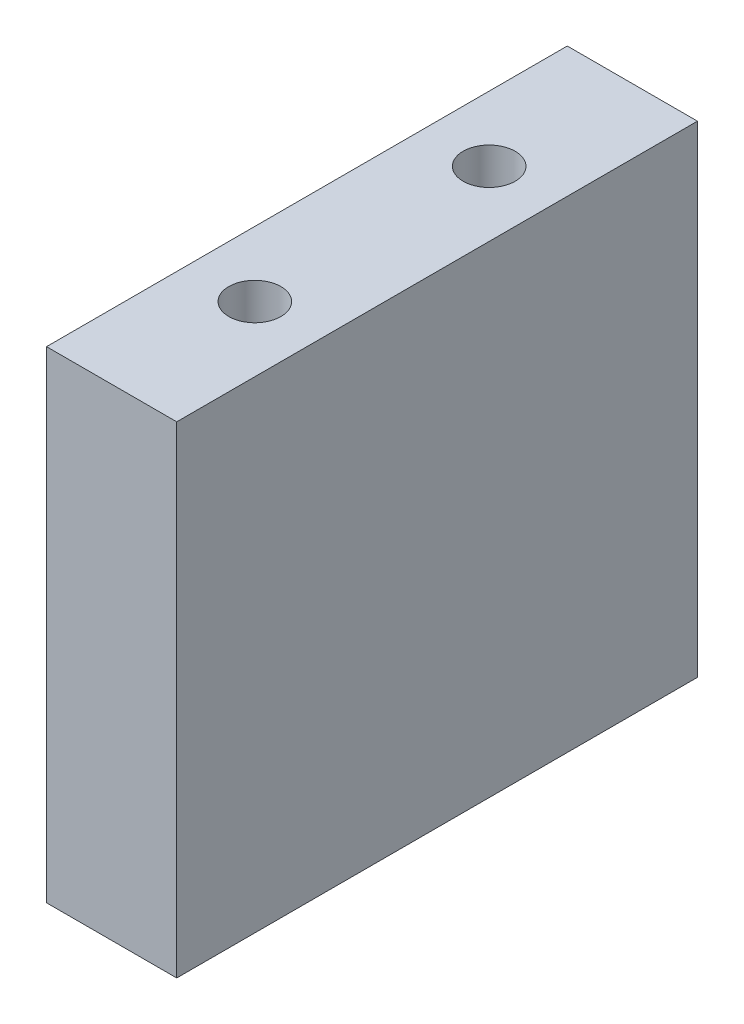
from build123d import *

# Parameters (mm, degrees)
CROQUIS1_W              = 80
CROQUIS1_H              = 74
SALIENTE_EXTRUIR1_DEPTH = 20
CROQUIS3_R              = 4
CORTAR_EXTRUIR2_DEPTH   = 25
CROQUIS4_R              = 4
CORTAR_EXTRUIR3_DEPTH   = 30


with BuildPart() as part:
    # Croquis1 → Saliente-Extruir1 (new body)
    with BuildSketch(Plane(origin=(0, 0, 0), x_dir=(0, 0, -1), z_dir=(1, 0, 0))):
        Rectangle(CROQUIS1_W, CROQUIS1_H)
    extrude(amount=-SALIENTE_EXTRUIR1_DEPTH)

    # Croquis3 → Cortar-Extruir2 (cut)
    with BuildSketch(Plane(origin=(0, 37, 0), x_dir=(1, 0, 0), z_dir=(0, 1, 0))):
        with Locations(Location((-10, -18, 0), (0, 0, 270))):
            Circle(CROQUIS3_R)
        with Locations(Location((-10, 18, 0), (0, 0, 270))):
            Circle(CROQUIS3_R)
    extrude(amount=-CORTAR_EXTRUIR2_DEPTH, mode=Mode.SUBTRACT)

    # Croquis4 → Cortar-Extruir3 (cut)
    with BuildSketch(Plane.XZ.offset(37)):
        with Locations(Location((-10, 30, 0), (0, 0, 270))):
            Circle(CROQUIS4_R)
        with Locations(Location((-10, -30, 0), (0, 0, 270))):
            Circle(CROQUIS4_R)
    extrude(amount=-CORTAR_EXTRUIR3_DEPTH, mode=Mode.SUBTRACT)


solid = part.part
